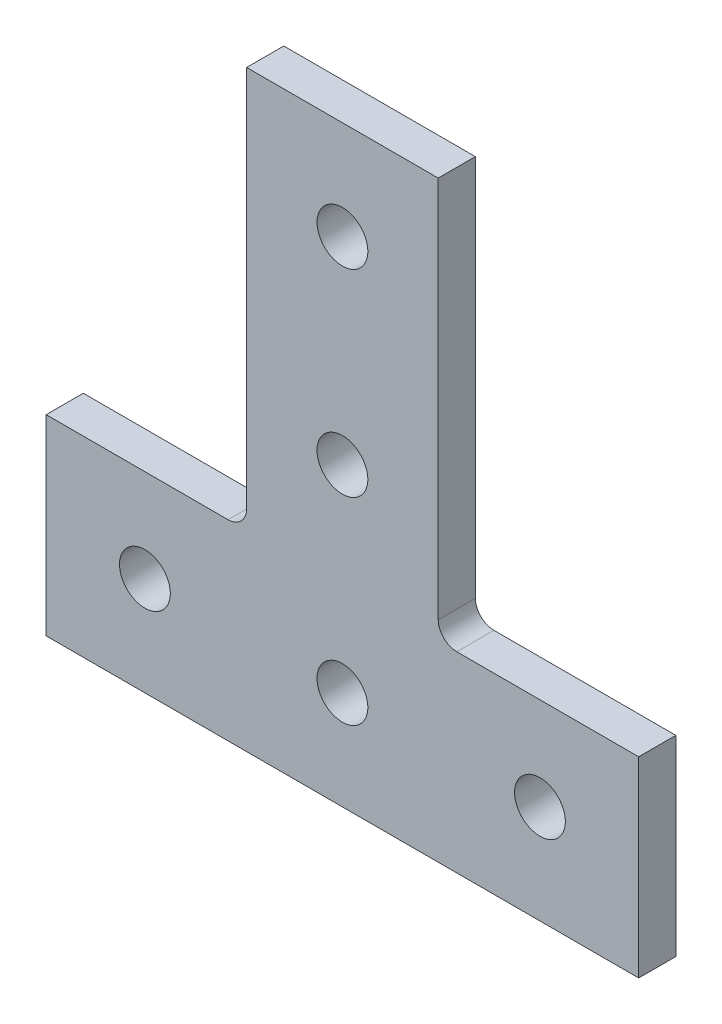
from build123d import *

# Parameters (mm, degrees)
SKETCH1_R           = 3.2639
BOSS_EXTRUDE1_DEPTH = 4.7752


with BuildPart() as part:
    # Sketch1 → Boss-Extrude1 (new body)
    with BuildSketch(Plane.XY.offset(4.7752)):
        with BuildLine():
            Line((-14.7066, 24.638), (-38.1, 24.638))
            Line((-38.1, 24.638), (-38.1, 0))
            Line((-38.1, 0), (38.1, 0))
            Line((38.1, 0), (38.1, 24.638))
            Line((38.1, 24.638), (14.7066, 24.638))
            ThreePointArc((14.7066, 24.638), (13.018311849, 25.337311849), (12.319, 27.0256))
            Line((12.319, 27.0256), (12.319, 76.2))
            Line((12.319, 76.2), (-12.319, 76.2))
            Line((-12.319, 76.2), (-12.319, 27.0256))
            ThreePointArc((-12.319, 27.0256), (-13.018311849, 25.337311849), (-14.7066, 24.638))
        make_face()
        with Locations(Location((-25.4, 12.7, 0), (0, 0, 180))):
            Circle(SKETCH1_R, mode=Mode.SUBTRACT)
        with Locations(Location((0, 38.1, 0), (0, 0, 180))):
            Circle(SKETCH1_R, mode=Mode.SUBTRACT)
        with Locations(Location((0, 63.5, 0), (0, 0, 180))):
            Circle(SKETCH1_R, mode=Mode.SUBTRACT)
        with Locations(Location((0, 12.7, 0), (0, 0, 180))):
            Circle(SKETCH1_R, mode=Mode.SUBTRACT)
        with Locations(Location((25.4, 12.7, 0), (0, 0, 180))):
            Circle(SKETCH1_R, mode=Mode.SUBTRACT)
    extrude(amount=-BOSS_EXTRUDE1_DEPTH)


solid = part.part
